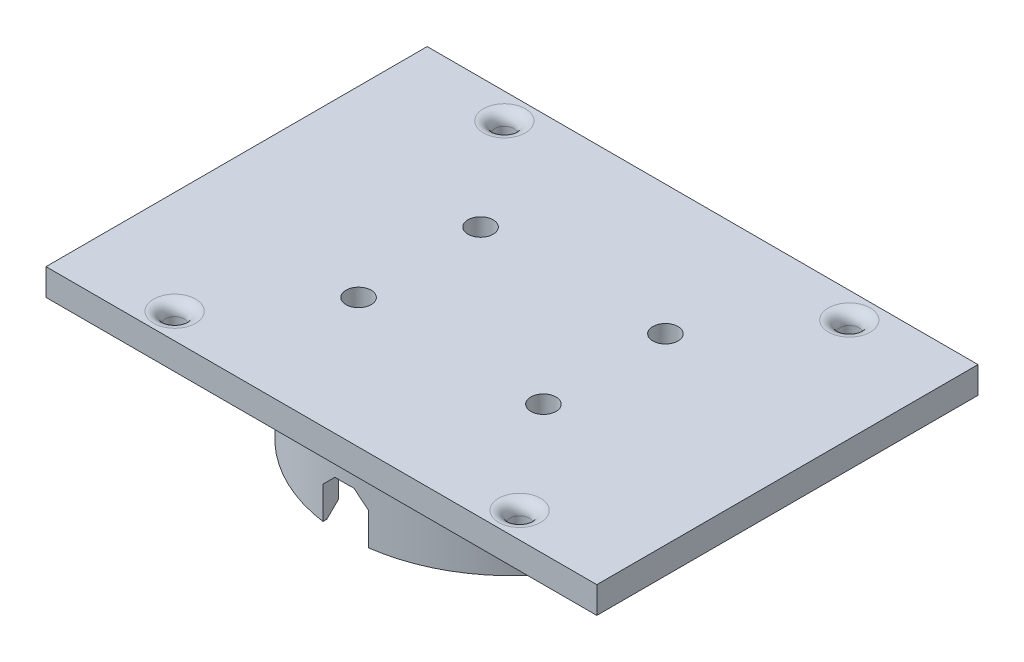
from build123d import *

# Parameters (mm, degrees)
SKETCH1_W               = 72.25
SKETCH1_H               = 50
BOSS_EXTRUDE1_DEPTH     = 2
SKETCH2_R               = 1.65
CUT_EXTRUDE1_DEPTH      = 10
SKETCH3_R               = 22
SKETCH3_R_2             = 20
BOSS_EXTRUDE2_DEPTH     = 10
CHAMFER2_SIZE           = 1.5
CUT_EXTRUDE3_DEPTH      = 46.541361695
CUT_EXTRUDE3_DEPTH_BACK = 46.541361695
SKETCH6_W               = 9
SKETCH6_H               = 10
SKETCH4_W               = 3
SKETCH4_H               = 6
BOSS_EXTRUDE3_DEPTH     = 6
FILLET1_R               = 0.5
CUT_EXTRUDE2_REACH      = 52.433
SKETCH5_R               = 1.75
CHAMFER3_SIZE           = 1.5
SKETCH7_R               = 1.25
CUT_EXTRUDE4_DEPTH      = 10
FILLET2_R               = 1.5
CUT_EXTRUDE5_DEPTH      = 46.541361695
CUT_EXTRUDE5_DEPTH_BACK = 46.541361695
SKETCH8_W               = 6
SKETCH8_H               = 6
CHAMFER4_SIZE           = 1.75
CHAMFER5_SIZE           = 0.5


with BuildPart() as part:
    # Sketch1 → Boss-Extrude1 (new, symmetric)
    with BuildSketch(Plane(origin=(0, 0, 0), x_dir=(1, 0, 0), z_dir=(0, 1, 0))):
        Rectangle(SKETCH1_W, SKETCH1_H)
    extrude(amount=BOSS_EXTRUDE1_DEPTH, both=True)

    # Sketch2 → Cut-Extrude1 (cut)
    with BuildSketch(Plane(origin=(0, 2, 0), x_dir=(1, 0, 0), z_dir=(0, 1, 0))):
        with Locations(Location((12.125, -8, 0), (0, 0, 270))):
            Circle(SKETCH2_R)
        with Locations(Location((12.125, 8, 0), (0, 0, 270))):
            Circle(SKETCH2_R)
        with Locations(Location((-12.125, -8, 0), (0, 0, 90))):
            Circle(SKETCH2_R)
        with Locations(Location((-12.125, 8, 0), (0, 0, 90))):
            Circle(SKETCH2_R)
    extrude(amount=-CUT_EXTRUDE1_DEPTH, mode=Mode.SUBTRACT)

    # Sketch3 → Boss-Extrude2 (add)
    with BuildSketch(Plane.XZ.offset(2)):
        with Locations(Location((0, 0, 0), (0, 0, 270))):
            Circle(SKETCH3_R)
        with Locations(Location((0, 0, 0), (0, 0, 270))):
            Circle(SKETCH3_R_2, mode=Mode.SUBTRACT)
    extrude(amount=BOSS_EXTRUDE2_DEPTH)

    # Chamfer2
    chamfer2_edges = [part.edges().sort_by_distance(p)[0] for p in [
        (0, -12, 20),
    ]]
    chamfer(chamfer2_edges, length=CHAMFER2_SIZE)

    # Sketch6 → Cut-Extrude3 (cut, two sides: drawn at the far end of the back side and taken through both)
    with BuildSketch(Plane(origin=(0, 0, 0), x_dir=(0, 0, -1), z_dir=(1, 0, 0)).offset(-CUT_EXTRUDE3_DEPTH_BACK)):
        with Locations((0, -7)):
            Rectangle(SKETCH6_W, SKETCH6_H)
    extrude(amount=CUT_EXTRUDE3_DEPTH + CUT_EXTRUDE3_DEPTH_BACK, mode=Mode.SUBTRACT)

    # Sketch4 → Boss-Extrude3 (add)
    with BuildSketch(Plane.XZ.offset(2)):
        with Locations((-4.5, 0)):
            Rectangle(SKETCH4_W, SKETCH4_H)
        with Locations((4.5, 0)):
            Rectangle(SKETCH4_W, SKETCH4_H)
    extrude(amount=BOSS_EXTRUDE3_DEPTH)

    # Fillet1
    fillet1_edges = [part.edges().sort_by_distance(p)[0] for p in [
        (6, -2, 0),
        (4.5, -2, 3),
        (3, -2, 0),
        (4.5, -2, -3),
        (-3, -2, 0),
        (-4.5, -2, 3),
        (-6, -2, 0),
        (-4.5, -2, -3),
    ]]
    fillet(fillet1_edges, radius=FILLET1_R)

    # Cut-Extrude2: up to this face of the body (flat: up to its plane)
    cut_extrude2_end = Plane(part.part.faces().sort_by_distance((6, -5.25, 0))[0])
    # Sketch5 → Cut-Extrude2 (cut, up to the picked face)
    with BuildSketch(Plane.ZY.offset(6), mode=Mode.PRIVATE) as cut_extrude2_sk1:
        with Locations((0, -5.25)):
            Circle(SKETCH5_R)
    cut_extrude2_tool1 = split(extrude(cut_extrude2_sk1.sketch, amount=-CUT_EXTRUDE2_REACH, mode=Mode.PRIVATE), bisect_by=cut_extrude2_end, keep=Keep.BOTH, mode=Mode.PRIVATE)
    add(cut_extrude2_tool1.solids().sort_by(Axis((-6, -5.25, 0), (1, 0, 0)))[0], mode=Mode.SUBTRACT)

    # Chamfer3
    chamfer3_edges = [part.edges().sort_by_distance(p)[0] for p in [
        (4.5, -8, 3),
        (4.5, -8, -3),
        (-4.5, -8, 3),
        (-4.5, -8, -3),
    ]]
    chamfer(chamfer3_edges, length=CHAMFER3_SIZE)

    # Sketch7 → Cut-Extrude4 (cut)
    with BuildSketch(Plane(origin=(0, 2, 0), x_dir=(1, 0, 0), z_dir=(0, 1, 0))):
        with Locations(Location((-22.625, 21.625, 0), (0, 0, 270))):
            Circle(SKETCH7_R)
        with Locations(Location((-22.625, -21.625, 0), (0, 0, 270))):
            Circle(SKETCH7_R)
        with Locations(Location((22.625, -21.625, 0), (0, 0, 90))):
            Circle(SKETCH7_R)
        with Locations(Location((22.625, 21.625, 0), (0, 0, 90))):
            Circle(SKETCH7_R)
    extrude(amount=-CUT_EXTRUDE4_DEPTH, mode=Mode.SUBTRACT)

    # Fillet2
    fillet2_edges = [part.edges().sort_by_distance(p)[0] for p in [
        (22.625, -2, -20.375),
        (22.625, 2, -20.375),
        (22.625, -2, 22.875),
        (22.625, 2, 22.875),
        (-22.625, -2, 20.375),
        (-22.625, 2, 20.375),
        (-22.625, -2, -22.875),
        (-22.625, 2, -22.875),
    ]]
    fillet(fillet2_edges, radius=FILLET2_R)

    # Sketch8 → Cut-Extrude5 (cut, two sides: drawn at the far end of the back side and taken through both)
    with BuildSketch(Plane.XY.offset(-CUT_EXTRUDE5_DEPTH_BACK)):
        with Locations((0, -9)):
            Rectangle(SKETCH8_W, SKETCH8_H)
    extrude(amount=CUT_EXTRUDE5_DEPTH + CUT_EXTRUDE5_DEPTH_BACK, mode=Mode.SUBTRACT)

    # Chamfer4
    chamfer4_edges = [part.edges().sort_by_distance(p)[0] for p in [
        (-3, -6, 20.784107325),
        (-3, -6, -20.784107325),
        (3, -6, 20.784107325),
        (3, -6, -20.784107325),
        (20.511015369, -2, 4.5),
        (-20.511015369, -2, 4.5),
        (-20.511015369, -2, -4.5),
        (20.511015369, -2, -4.5),
    ]]
    chamfer(chamfer4_edges, length=CHAMFER4_SIZE)

    # Chamfer5
    chamfer5_edges = [part.edges().sort_by_distance(p)[0] for p in [
        (0, -2, 25),
        (-36.125, -2, 0),
        (0, -2, -25),
        (36.125, -2, 0),
    ]]
    chamfer(chamfer5_edges, length=CHAMFER5_SIZE)


solid = part.part
